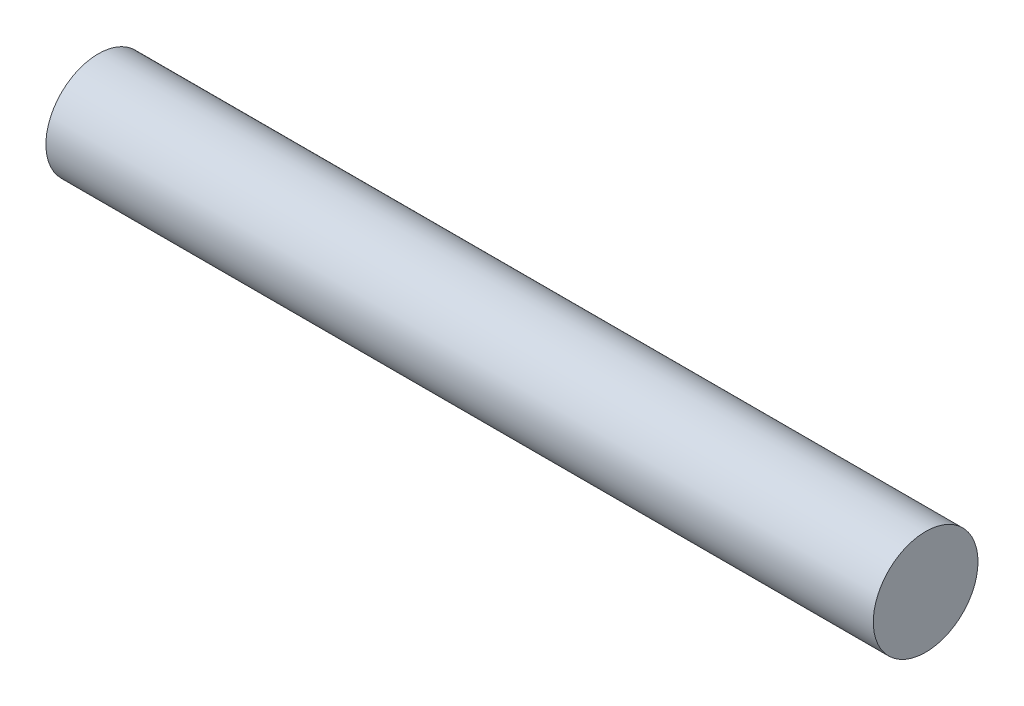
from build123d import *

# Parameters (mm, degrees)
ESQUISSE1_R        = 10.125
BOSS_EXTRU_1_DEPTH = 160


with BuildPart() as part:
    # Esquisse1 → Boss.-Extru.1 (new body)
    with BuildSketch(Plane(origin=(0, 0, 0), x_dir=(0, 0, -1), z_dir=(1, 0, 0))):
        Circle(ESQUISSE1_R)
    extrude(amount=BOSS_EXTRU_1_DEPTH)


solid = part.part
